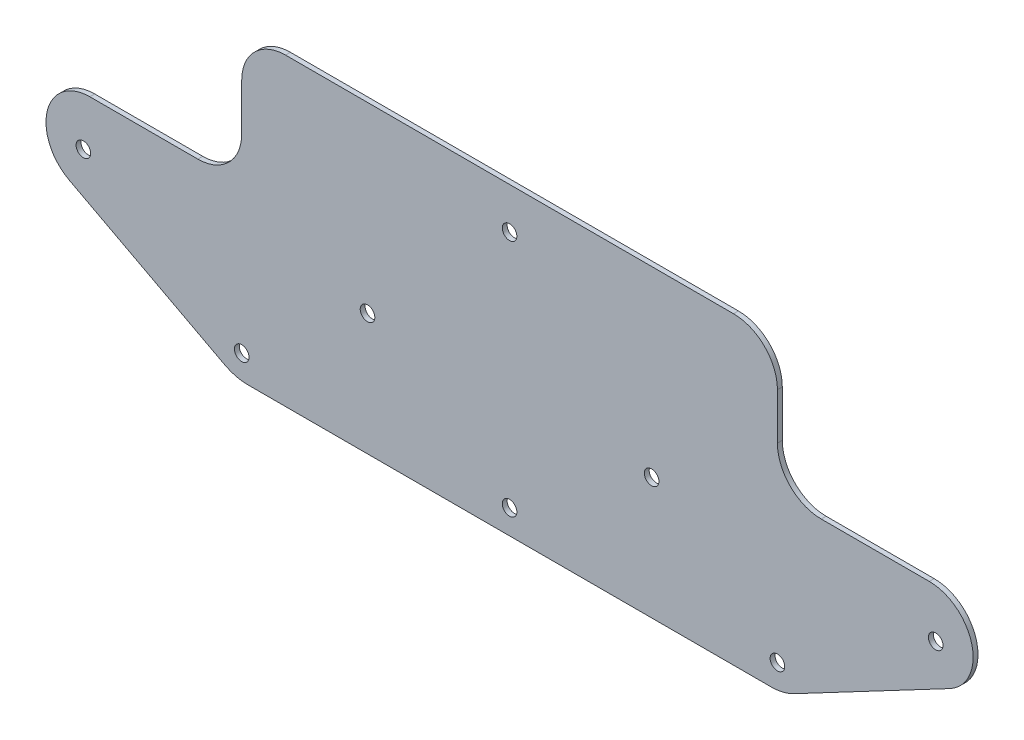
from build123d import *

# Parameters (mm, degrees)
ESQUISSE1_R        = 3
BOSS_EXTRU_1_DEPTH = 2
CONG_1_R           = 18
CONG_2_R           = 20


with BuildPart() as part:
    # Esquisse1 → Boss.-Extru.1 (new body)
    with BuildSketch(Plane.XY):
        Polygon((-244.958991582, 40), (-110, 40), (-110, 95), (110, 95), (110, 40), (244.958991582, 40), (112.479495791, -30), (-112.479495791, -30), align=None)
        with Locations((-175, 20)):
            Circle(ESQUISSE1_R, mode=Mode.SUBTRACT)
        with Locations((-110, -20)):
            Circle(ESQUISSE1_R, mode=Mode.SUBTRACT)
        with Locations((110, -20)):
            Circle(ESQUISSE1_R, mode=Mode.SUBTRACT)
        with Locations((175, 20)):
            Circle(ESQUISSE1_R, mode=Mode.SUBTRACT)
        with Locations((0, -20)):
            Circle(ESQUISSE1_R, mode=Mode.SUBTRACT)
        with Locations((-58.333333333, 20)):
            Circle(ESQUISSE1_R, mode=Mode.SUBTRACT)
        with Locations((58.333333333, 20)):
            Circle(ESQUISSE1_R, mode=Mode.SUBTRACT)
        with Locations((0, 78.03)):
            Circle(ESQUISSE1_R, mode=Mode.SUBTRACT)
    extrude(amount=BOSS_EXTRU_1_DEPTH)

    # Congé1
    cong_1_edges = [part.edges().sort_by_distance(p)[0] for p in [
        (-244.958991582, 40, 1),
        (-110, 40, 1),
        (-110, 95, 1),
        (110, 95, 1),
        (110, 40, 1),
        (244.958991582, 40, 1),
    ]]
    fillet(cong_1_edges, radius=CONG_1_R)

    # Congé2
    cong_2_edges = [part.edges().sort_by_distance(p)[0] for p in [
        (112.479495791, -30, 1),
        (-112.479495791, -30, 1),
    ]]
    fillet(cong_2_edges, radius=CONG_2_R)


solid = part.part
